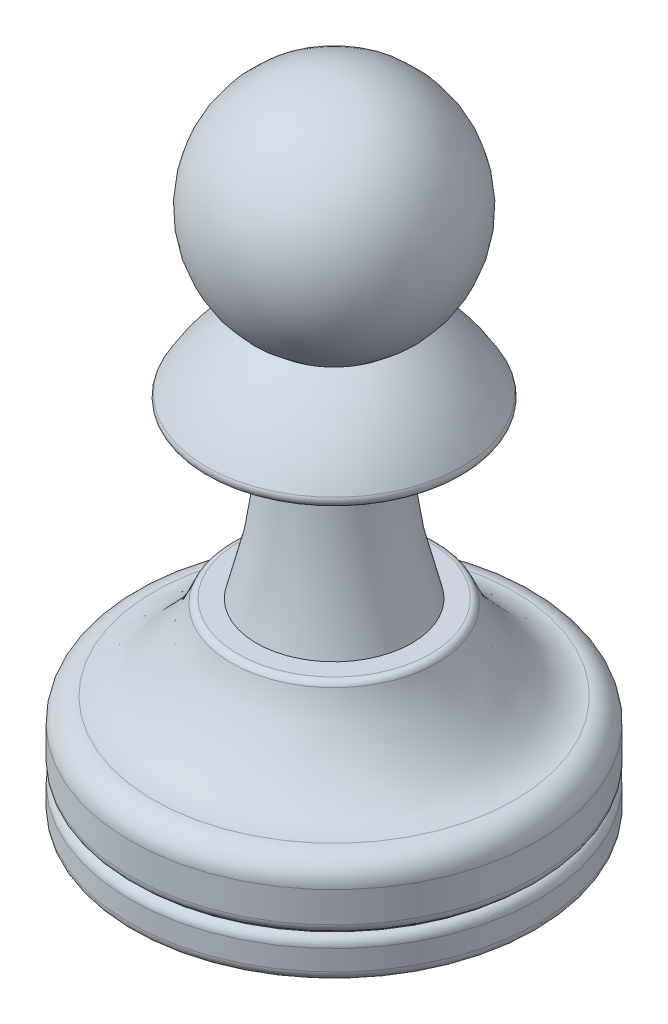
from build123d import *


with BuildPart() as part:
    # Sketch2 → Pawn (revolve)
    with BuildSketch(Plane.XY, mode=Mode.PRIVATE) as pawn_sk:
        with BuildLine():
            Line((185.564594357, 4.754988985), (185.564594357, 52.8583438))
            ThreePointArc((185.564594357, 52.8583438), (177.435174713, 46.862432987), (180.762630177, 37.324799615))
            ThreePointArc((180.762630177, 37.324799615), (178.060127536, 35.094741309), (175.997530405, 32.262361807))
            ThreePointArc((175.997530405, 32.262361807), (176.00505357, 31.75880579), (176.442443034, 31.509174628))
            Line((176.442443034, 31.509174628), (181.619914489, 31.509174628))
            ThreePointArc((181.619914489, 31.509174628), (181.150568392, 25.159966557), (179.752733241, 18.948784239))
            Line((179.752733241, 18.948784239), (178.36061713, 18.948784239))
            ThreePointArc((178.36061713, 18.948784239), (178.062940275, 18.852430312), (177.878185994, 18.599920026))
            add(Edge.make_bspline(
                [(177.878185994, 18.599920026), (177.4159763, 17.198699397), (175.902471026, 14.931249385), (173.624638006, 12.665478704), (172.060560706, 12.628492058)],
                knots=[0.03468651, 0.03468651, 0.03468651, 0.03468651, 0.457601346, 0.915202692, 0.915202692, 0.915202692, 0.915202692], degree=3))
            ThreePointArc((172.060560706, 12.628492058), (170.83058417, 12.093274816), (170.324594357, 10.850988985))
            Line((170.324594357, 10.850988985), (170.324594357, 8.564988985))
            ThreePointArc((170.324594357, 8.564988985), (170.464423962, 8.12504808), (170.832594357, 7.846568495))
            Line((170.832594357, 7.846568495), (170.832594357, 7.759409475))
            ThreePointArc((170.832594357, 7.759409475), (170.464423962, 7.48092989), (170.324594357, 7.040988985))
            Line((170.324594357, 7.040988985), (170.324594357, 5.516988985))
            ThreePointArc((170.324594357, 5.516988985), (170.547778989, 4.978173618), (171.086594357, 4.754988985))
            Line((171.086594357, 4.754988985), (185.564594357, 4.754988985))
        make_face()
    revolve(pawn_sk.sketch.rotate(Axis((185.564594357, 4.754988985, 0), (0, 1, 0)), 180), axis=Axis((185.564594357, 4.754988985, 0), (0, 1, 0)))


solid = part.part
